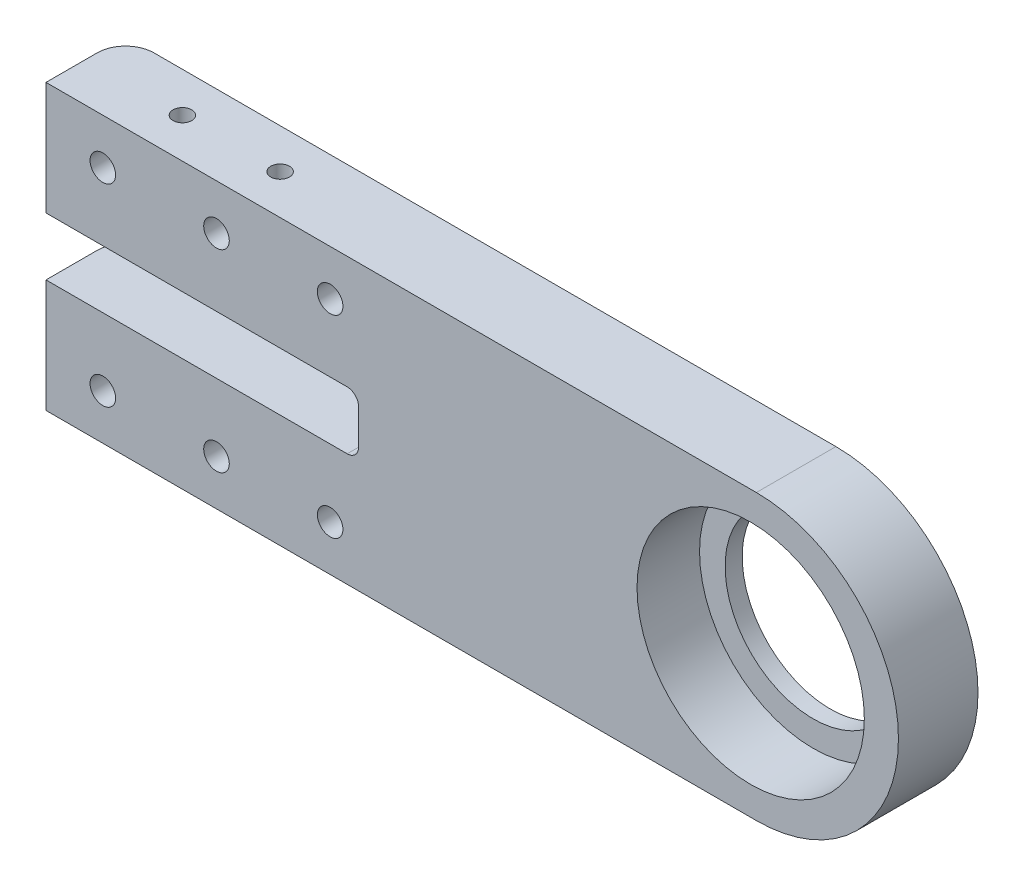
from build123d import *

# Parameters (mm, degrees)
BOSS_EXTRUDE1_DEPTH                             = 14
SKETCH2_W                                       = 55
SKETCH2_H                                       = 10.2
CUT_EXTRUDE1_DEPTH                              = 159.732479348
CSK_FOR_M4_FLAT_HEAD_MACHINE_SCREW1_D           = 4.5
CSK_FOR_M4_FLAT_HEAD_MACHINE_SCREW1_CSINK_D     = 9.4
CSK_FOR_M4_FLAT_HEAD_MACHINE_SCREW1_CSINK_ANGLE = 90
M4X0_7_TAPPED_HOLE1_D                           = 3.3
M4X0_7_TAPPED_HOLE1_DEPTH                       = 19.899999999
HOLE1_D                                         = 31.000000009
HOLE1_CBORE_D                                   = 40.00000001
HOLE1_CBORE_DEPTH                               = 11
FILLET1_R                                       = 2
FILLET2_R                                       = 5


with BuildPart() as part:
    # Sketch1 → Boss-Extrude1 (new body)
    with BuildSketch(Plane(origin=(0, 0, 0), x_dir=(-1, 0, 0), z_dir=(0, 0, -1))):
        with BuildLine():
            Line((0, 0), (-125, 0))
            ThreePointArc((-125, 0), (-150, -25), (-125, -50))
            Line((-125, -50), (0, -50))
            Line((0, -50), (0, 0))
        make_face()
    extrude(amount=-BOSS_EXTRUDE1_DEPTH)

    # Sketch2 → Cut-Extrude1 (cut, through all)
    with BuildSketch(Plane.XY.offset(14)):
        with Locations((27.5, -24.999999999)):
            Rectangle(SKETCH2_W, SKETCH2_H)
    extrude(amount=-CUT_EXTRUDE1_DEPTH, mode=Mode.SUBTRACT)

    # CSK for M4 Flat Head Machine Screw1 (through all)
    with Locations(Plane(origin=(0, 0, 0), x_dir=(-1, 0, 0), z_dir=(0, 0, -1))):
        with Locations((-10, -8), (-10, -42), (-30, -42), (-30, -8), (-50, -8), (-50, -42)):
            CounterSinkHole(CSK_FOR_M4_FLAT_HEAD_MACHINE_SCREW1_D / 2, CSK_FOR_M4_FLAT_HEAD_MACHINE_SCREW1_CSINK_D / 2, counter_sink_angle=CSK_FOR_M4_FLAT_HEAD_MACHINE_SCREW1_CSINK_ANGLE)

    # M4x0.7 Tapped Hole1
    with Locations(Plane(origin=(0, 0, 0), x_dir=(1, 0, 0), z_dir=(0, 1, 0))):
        with Locations((17, -7), (34.2, -7)):
            Hole(M4X0_7_TAPPED_HOLE1_D / 2, depth=M4X0_7_TAPPED_HOLE1_DEPTH)

    # Hole1 (through all)
    with Locations(Plane.XY.offset(14)):
        with Locations((123.999999995, -24.999999999)):
            CounterBoreHole(HOLE1_D / 2, HOLE1_CBORE_D / 2, HOLE1_CBORE_DEPTH)

    # Fillet1
    fillet1_edges = [part.edges().sort_by_distance(p)[0] for p in [
        (55, -19.899999999, 7),
        (55, -30.099999999, 7),
    ]]
    fillet(fillet1_edges, radius=FILLET1_R)

    # Fillet2
    fillet2_edges = [part.edges().sort_by_distance(p)[0] for p in [
        (0, -9.95, 0),
        (0, -40.05, 0),
    ]]
    fillet(fillet2_edges, radius=FILLET2_R)


solid = part.part
